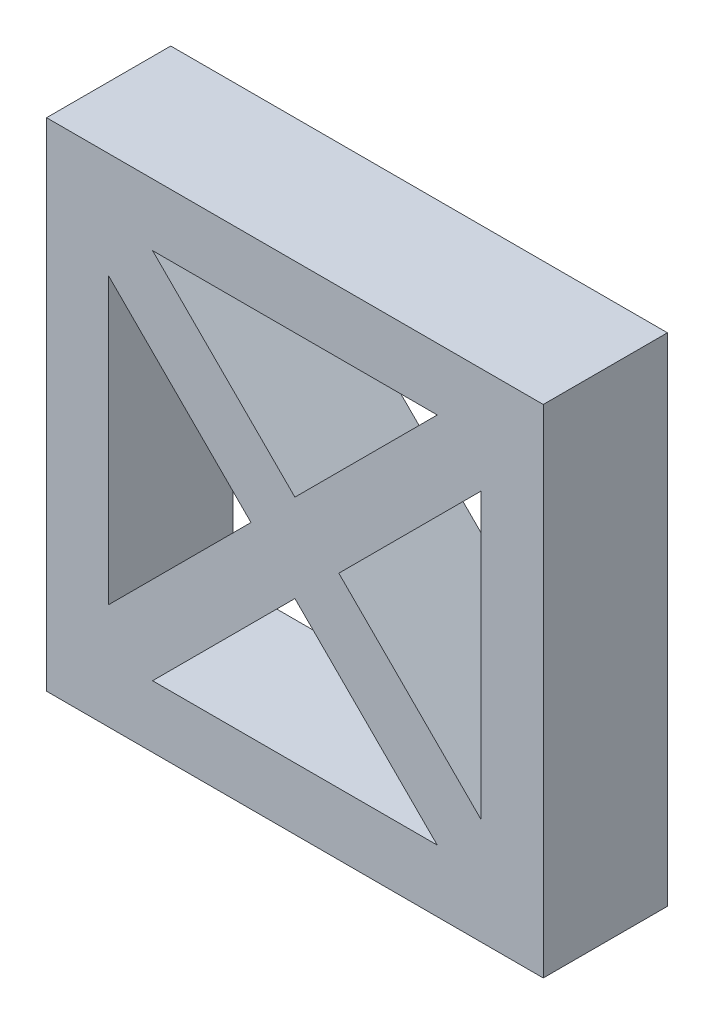
from build123d import *

# Parameters (mm, degrees)
SKETCH1_W           = 40
SKETCH1_H           = 40
BOSS_EXTRUDE1_DEPTH = 10


with BuildPart() as part:
    # Sketch1 → Boss-Extrude1 (new body)
    with BuildSketch(Plane.XY):
        with Locations((20, 20)):
            Rectangle(SKETCH1_W, SKETCH1_H)
        Polygon((5, 8.535533906), (5, 31.464466094), (16.464466094, 20), align=None, mode=Mode.SUBTRACT)
        Polygon((31.464466094, 5), (8.535533906, 5), (20, 16.464466094), align=None, mode=Mode.SUBTRACT)
        Polygon((35, 31.464466094), (35, 8.535533906), (23.535533906, 20), align=None, mode=Mode.SUBTRACT)
        Polygon((8.535533906, 35), (31.464466094, 35), (20, 23.535533906), align=None, mode=Mode.SUBTRACT)
    extrude(amount=BOSS_EXTRUDE1_DEPTH)


solid = part.part
